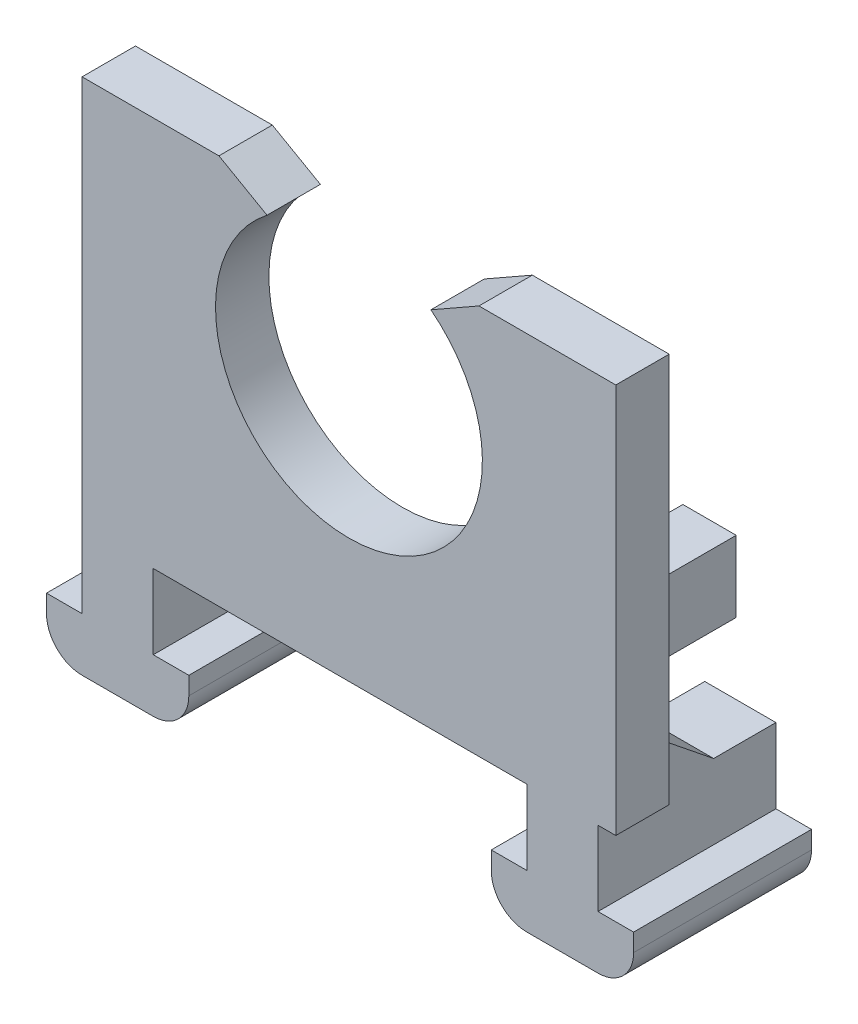
from build123d import *

# Parameters (mm, degrees)
EXTRUDE_1_DEPTH      = 2
EXTRUDE_1_DEPTH_BACK = 1
BOSS_EXTRUDE1_DEPTH  = 10
LPATTERN1_COUNT      = 2
LPATTERN1_PITCH      = 25
SKETCH2_W            = 3
SKETCH2_H            = 4
BOSS_EXTRUDE2_DEPTH  = 14
BOSS_EXTRUDE3_DEPTH  = 4
LPATTERN2_COUNT      = 2
LPATTERN2_PITCH      = 25
CUT_EXTRUDE1_DEPTH   = 10


with BuildPart() as part:
    # Эскиз2 → Бобышка-Вытянуть1 (new, two sides: drawn at the far end of the back side and taken through both)
    with BuildSketch(Plane.XY.offset(-EXTRUDE_1_DEPTH_BACK)):
        Polygon((18.01429863, 0), (18.01429863, 26.7), (-11.98570137, 26.7), (-11.98570137, -2.25), (18.01429863, -2.25), align=None)
    extrude(amount=EXTRUDE_1_DEPTH + EXTRUDE_1_DEPTH_BACK)

    # Sketch1 → Boss-Extrude1 (add)
    with BuildSketch(Plane.XY.offset(2)):
        with BuildLine():
            Line((-5.98570137, -6.45), (-7.98570137, -6.45))
            Line((-7.98570137, -6.45), (-7.98570137, -2.25))
            Line((-7.98570137, -2.25), (-11.98570137, -2.25))
            Line((-11.98570137, -2.25), (-11.98570137, -6.45))
            Line((-11.98570137, -6.45), (-13.98570137, -6.45))
            Line((-13.98570137, -6.45), (-13.98570137, -7.45))
            ThreePointArc((-13.98570137, -7.45), (-13.399914932, -8.864213562), (-11.98570137, -9.45))
            Line((-11.98570137, -9.45), (-7.98570137, -9.45))
            ThreePointArc((-7.98570137, -9.45), (-6.571487808, -8.864213562), (-5.98570137, -7.45))
            Line((-5.98570137, -7.45), (-5.98570137, -6.45))
        make_face()
    boss_extrude1 = extrude(amount=-BOSS_EXTRUDE1_DEPTH)

    # LPattern1: Boss-Extrude1 ×2
    with Locations(*[(i * LPATTERN1_PITCH, 0, 0) for i in range(1, LPATTERN1_COUNT)]):
        add(boss_extrude1)

    # Sketch2 → Boss-Extrude2 (add)
    with BuildSketch(Plane(origin=(0, 0, 2), x_dir=(-1, 0, 0), z_dir=(0, 0, -1))):
        with Locations((-9.283605158, -0.25)):
            Rectangle(SKETCH2_W, SKETCH2_H)
    extrude(amount=BOSS_EXTRUDE2_DEPTH)

    # Sketch3 → Boss-Extrude3 (add)
    with BuildSketch(Plane.ZY.offset(-13.01429863)):
        Polygon((-4.5, -2.25), (-1, -2.25), (-1, 0.558861968), align=None)
    boss_extrude3 = extrude(amount=-BOSS_EXTRUDE3_DEPTH)

    # LPattern2: Boss-Extrude3 ×2
    with Locations(*[(-i * LPATTERN2_PITCH, 0, 0) for i in range(1, LPATTERN2_COUNT)]):
        add(boss_extrude3)

    # Sketch4 → Cut-Extrude1 (cut)
    with BuildSketch(Plane(origin=(0, 0, -1), x_dir=(-1, 0, 0), z_dir=(0, 0, -1))):
        with BuildLine():
            Line((-10.321327868, 19.682942102), (-7.619737196, 18.144453997))
            ThreePointArc((-7.619737196, 18.144453997), (-9.751909083, 15.519632814), (-10.51429863, 12.225))
            ThreePointArc((-10.51429863, 12.225), (-3.01429863, 4.725), (4.48570137, 12.225))
            ThreePointArc((4.48570137, 12.225), (3.723311823, 15.519632814), (1.591139935, 18.144453997))
            Line((1.591139935, 18.144453997), (4.292730608, 19.682942102))
            Line((4.292730608, 19.682942102), (13.385264368, 19.682942102))
            Line((13.385264368, 19.682942102), (19.56091022, 30.423181844))
            Line((19.56091022, 30.423181844), (-22.587954431, 29.74009492))
            Line((-22.587954431, 29.74009492), (-18.01429863, 19.682942102))
            Line((-18.01429863, 19.682942102), (-10.321327868, 19.682942102))
        make_face()
    extrude(amount=-CUT_EXTRUDE1_DEPTH, mode=Mode.SUBTRACT)


solid = part.part
